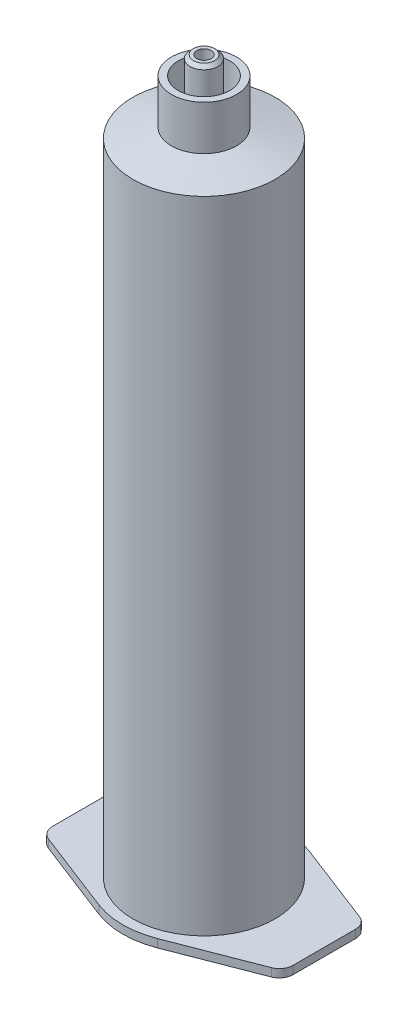
from build123d import *

# Parameters (mm, degrees)
SKETCH_2_R      = 9.5
EXTRUDE_1_DEPTH = 1.2


with BuildPart() as part:
    # Эскиз1 → Повернуть1 (revolve)
    with BuildSketch(Plane.XY, mode=Mode.PRIVATE) as revolve_1_sk:
        Polygon((1.05, 5.570639193), (1.55, 5.570639193), (2.05, 5.070639193), (2.05, -3.008676838), (3.8, -3.447871743), (3.8, 2.870639193), (4.8, 2.870639193), (4.8, -3.69884026), (10.5, -5.129360807), (10.5, -99.629360807), (9.5, -99.629360807), (9.5, -5.909404025), (1.05, -3.788720055), align=None)
    revolve(revolve_1_sk.sketch.rotate(Axis((0, 0, 0), (0, -1, 0)), 90), axis=Axis((0, 0, 0), (0, -1, 0)))

    # Эскиз2 → Бобышка-Вытянуть1 (add)
    with BuildSketch(Plane.XZ.offset(99.629360807)):
        with BuildLine():
            Line((16.471592317, -6.494555517), (4.329553903, -11.191736371))
            ThreePointArc((4.329553903, -11.191736371), (0, -12), (-4.329553903, -11.191736371))
            Line((-4.329553903, -11.191736371), (-16.471592317, -6.494555517))
            ThreePointArc((-16.471592317, -6.494555517), (-17.399724922, -5.759933042), (-17.75, -4.629266122))
            Line((-17.75, -4.629266122), (-17.75, 4.629266122))
            ThreePointArc((-17.75, 4.629266122), (-17.399724922, 5.759933042), (-16.471592317, 6.494555517))
            Line((-16.471592317, 6.494555517), (-4.329553903, 11.191736371))
            ThreePointArc((-4.329553903, 11.191736371), (0, 12), (4.329553903, 11.191736371))
            Line((4.329553903, 11.191736371), (16.471592317, 6.494555517))
            ThreePointArc((16.471592317, 6.494555517), (17.399724922, 5.759933042), (17.75, 4.629266122))
            Line((17.75, 4.629266122), (17.75, -4.629266122))
            ThreePointArc((17.75, -4.629266122), (17.399724922, -5.759933042), (16.471592317, -6.494555517))
        make_face()
        with Locations(Location((0, 0, 0), (0, 0, 270))):
            Circle(SKETCH_2_R, mode=Mode.SUBTRACT)
    extrude(amount=EXTRUDE_1_DEPTH)


solid = part.part
